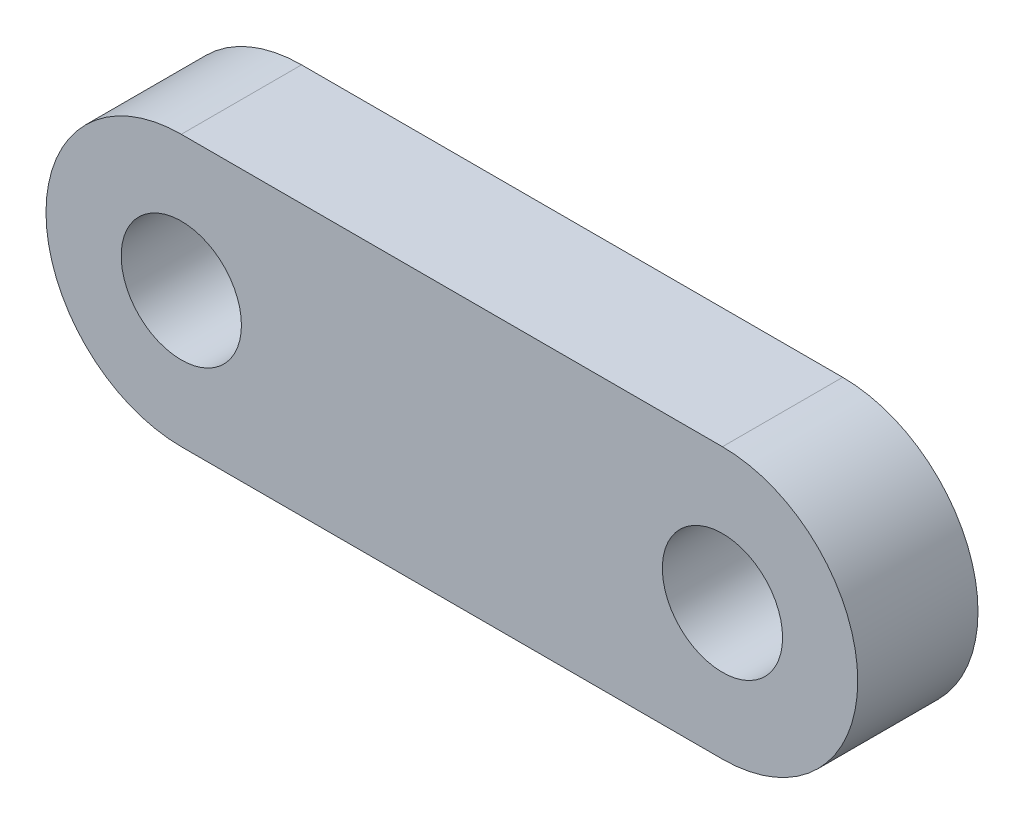
from build123d import *

# Parameters (mm, degrees)
SKETCH_1_R      = 2
EXTRUDE_1_DEPTH = 4


with BuildPart() as part:
    # Эскиз1 → Вытянуть1 (new body)
    with BuildSketch(Plane.XY):
        with BuildLine():
            Line((0, 4.5), (18, 4.5))
            ThreePointArc((18, 4.5), (22.5, 0), (18, -4.5))
            Line((18, -4.5), (0, -4.5))
            ThreePointArc((0, -4.5), (-4.5, 0), (0, 4.5))
        make_face()
        Circle(SKETCH_1_R, mode=Mode.SUBTRACT)
        with Locations((18, 0)):
            Circle(SKETCH_1_R, mode=Mode.SUBTRACT)
    extrude(amount=EXTRUDE_1_DEPTH)


solid = part.part
